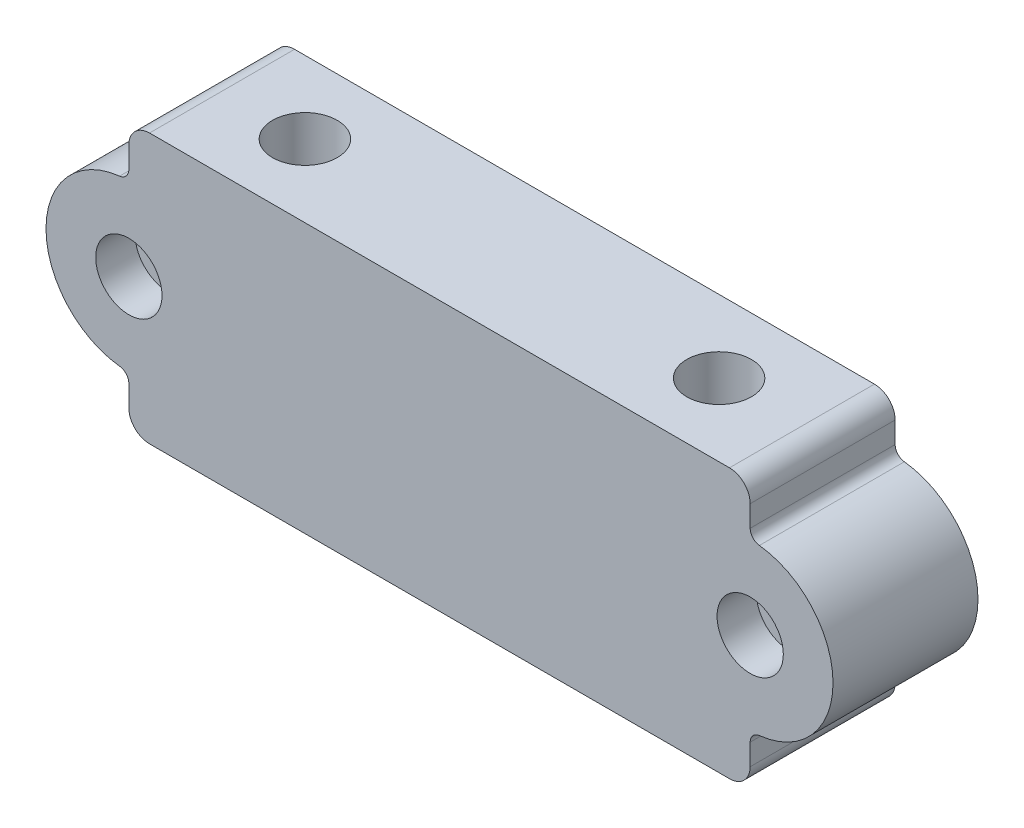
from build123d import *

# Parameters (mm, degrees)
SKETCH1_W           = 101.6
SKETCH1_H           = 17.78
SKETCH1_R           = 3.96875
BOSS_EXTRUDE1_DEPTH = 33.02
SKETCH2_R           = 2.4892
CUT_EXTRUDE1_DEPTH  = 17.78
SKETCH3_R           = 4.064
CUT_EXTRUDE2_DEPTH  = 4.826
CUT_EXTRUDE3_DEPTH  = 109.300548475
FILLET1_R           = 2.54


with BuildPart() as part:
    # Sketch1 → Boss-Extrude1 (new body)
    with BuildSketch(Plane(origin=(0, 0, 0), x_dir=(1, 0, 0), z_dir=(0, 1, 0))):
        with Locations((50.8, 8.89)):
            Rectangle(SKETCH1_W, SKETCH1_H)
        with Locations(Location((76.2, 8.89, 0), (0, 0, 270))):
            Circle(SKETCH1_R, mode=Mode.SUBTRACT)
        with Locations(Location((25.4, 8.89, 0), (0, 0, 270))):
            Circle(SKETCH1_R, mode=Mode.SUBTRACT)
    extrude(amount=-BOSS_EXTRUDE1_DEPTH)

    # Sketch2 → Cut-Extrude1 (cut)
    with BuildSketch(Plane.XY):
        with Locations((88.9, -16.51)):
            Circle(SKETCH2_R)
        with Locations((12.7, -16.51)):
            Circle(SKETCH2_R)
    extrude(amount=-CUT_EXTRUDE1_DEPTH, mode=Mode.SUBTRACT)

    # Sketch3 → Cut-Extrude2 (cut)
    with BuildSketch(Plane.XY):
        with Locations((88.9, -16.51)):
            Circle(SKETCH3_R)
        with Locations((12.7, -16.51)):
            Circle(SKETCH3_R)
    extrude(amount=-CUT_EXTRUDE2_DEPTH, mode=Mode.SUBTRACT)

    # Sketch5 → Cut-Extrude3 (cut, through all)
    with BuildSketch(Plane.XY):
        with BuildLine():
            Line((12.7, -5.150774674), (12.7, 0))
            Line((12.7, 0), (0, 0))
            Line((0, 0), (0, -33.02))
            Line((0, -33.02), (12.7, -33.02))
            Line((12.7, -33.02), (12.7, -27.869225326))
            ThreePointArc((12.7, -27.869225326), (12.37660211, -27.022558659), (11.571111111, -26.607089178))
            ThreePointArc((11.571111111, -26.607089178), (2.54, -16.51), (11.571111111, -6.412910822))
            ThreePointArc((11.571111111, -6.412910822), (12.37660211, -5.997441341), (12.7, -5.150774674))
        make_face()
        with BuildLine():
            Line((88.9, -5.150774674), (88.9, 0))
            Line((88.9, 0), (101.6, 0))
            Line((101.6, 0), (101.6, -33.02))
            Line((101.6, -33.02), (88.9, -33.02))
            Line((88.9, -33.02), (88.9, -27.869225326))
            ThreePointArc((88.9, -27.869225326), (89.22339789, -27.022558659), (90.028888889, -26.607089178))
            ThreePointArc((90.028888889, -26.607089178), (99.06, -16.51), (90.028888889, -6.412910822))
            ThreePointArc((90.028888889, -6.412910822), (89.22339789, -5.997441341), (88.9, -5.150774674))
        make_face()
    extrude(amount=-CUT_EXTRUDE3_DEPTH, mode=Mode.SUBTRACT)

    # Fillet1
    fillet1_edges = [part.edges().sort_by_distance(p)[0] for p in [
        (12.7, -33.02, -8.89),
        (12.7, 0, -8.89),
        (88.9, 0, -8.89),
        (88.9, -33.02, -8.89),
    ]]
    fillet(fillet1_edges, radius=FILLET1_R)


solid = part.part
